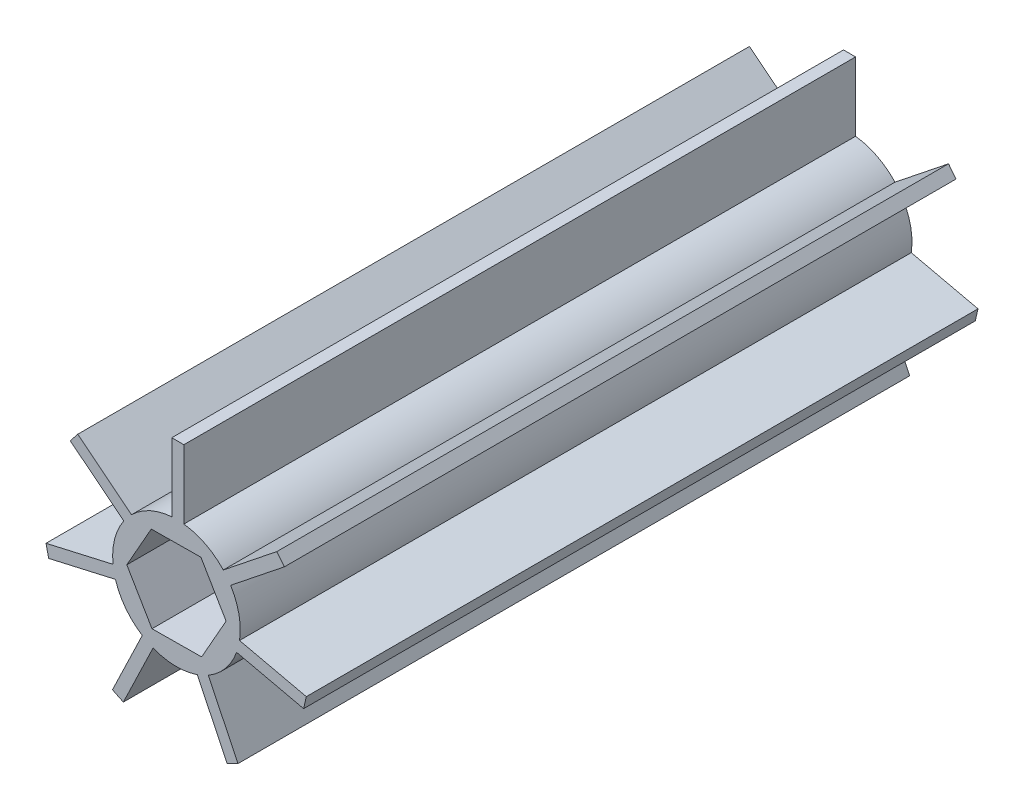
from build123d import *

# Parameters (mm, degrees)
BOSS_EXTRUDE1_DEPTH = 76.2
SKETCH6_R           = 7.239
BOSS_EXTRUDE2_DEPTH = 76.2
CIRPATTERN1_COUNT   = 7
CUT_EXTRUDE5_DEPTH  = 80.057508243


with BuildPart() as part:
    # Sketch12 → Boss-Extrude1 (new body)
    with BuildSketch(Plane.XY):
        Polygon((0, 0), (0.8406384, 0), (0.8406384, 14.987843642), (-0.5309616, 14.987843642), (-0.5309616, 0), align=None)
    boss_extrude1 = extrude(amount=-BOSS_EXTRUDE1_DEPTH)

    # Sketch6 → Boss-Extrude2 (add)
    with BuildSketch(Plane.XY):
        Circle(SKETCH6_R)
    extrude(amount=-BOSS_EXTRUDE2_DEPTH)

    # CirPattern1: Boss-Extrude1 ×7 about axis
    cirpattern1_axis = Axis((0, 0, -76.2), (0, 0, 1))
    for i in range(1, CIRPATTERN1_COUNT):
        add(boss_extrude1.rotate(cirpattern1_axis, i * 360 / CIRPATTERN1_COUNT))

    # Sketch8 → Cut-Extrude5 (cut, through all)
    with BuildSketch(Plane.XY):
        Polygon((5.6310401, 0.047871874), (2.774061791, 4.900559713), (-2.856978309, 4.852687839), (-5.6310401, -0.047871874), (-2.774061791, -4.900559713), (2.856978309, -4.852687839), align=None)
    extrude(amount=-CUT_EXTRUDE5_DEPTH, mode=Mode.SUBTRACT)


solid = part.part
